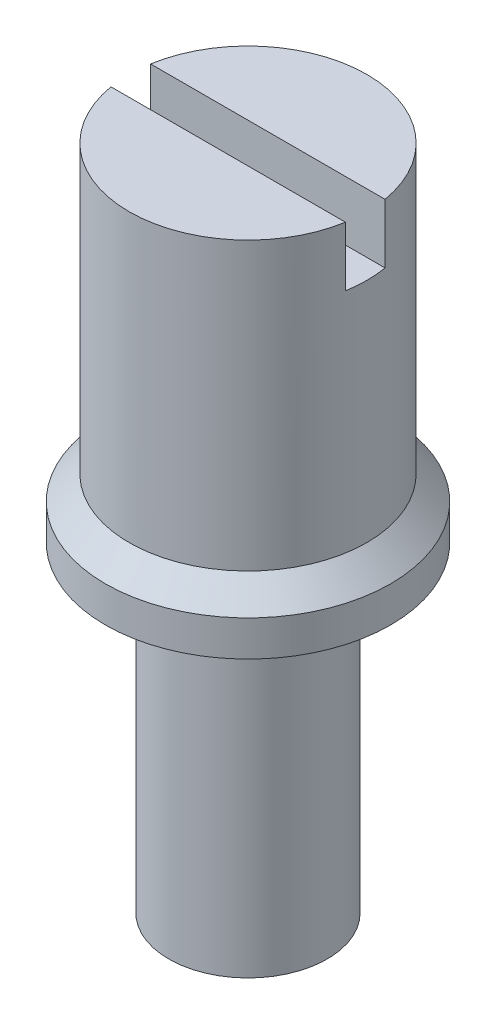
from build123d import *

# Parameters (mm, degrees)
SKETCH3_W          = 6
SKETCH3_H          = 1
CUT_EXTRUDE1_DEPTH = 1.5


with BuildPart() as part:
    # Sketch2 → Revolve1 (revolve)
    with BuildSketch(Plane.XY, mode=Mode.PRIVATE) as revolve1_sk:
        Polygon((0, -8.1), (2, -8.1), (2, 0), (3.6, 0), (3.6, 0.9), (3, 1.5), (3, 8.73125), (0, 8.73125), align=None)
    revolve(revolve1_sk.sketch.rotate(Axis((0, 43.323370715, 0), (0, -1, 0)), 180), axis=Axis((0, 43.323370715, 0), (0, -1, 0)))

    # Sketch3 → Cut-Extrude1 (cut)
    with BuildSketch(Plane(origin=(0, 8.73125, 0), x_dir=(1, 0, 0), z_dir=(0, 1, 0))):
        Rectangle(SKETCH3_W, SKETCH3_H)
    extrude(amount=-CUT_EXTRUDE1_DEPTH, mode=Mode.SUBTRACT)


solid = part.part
